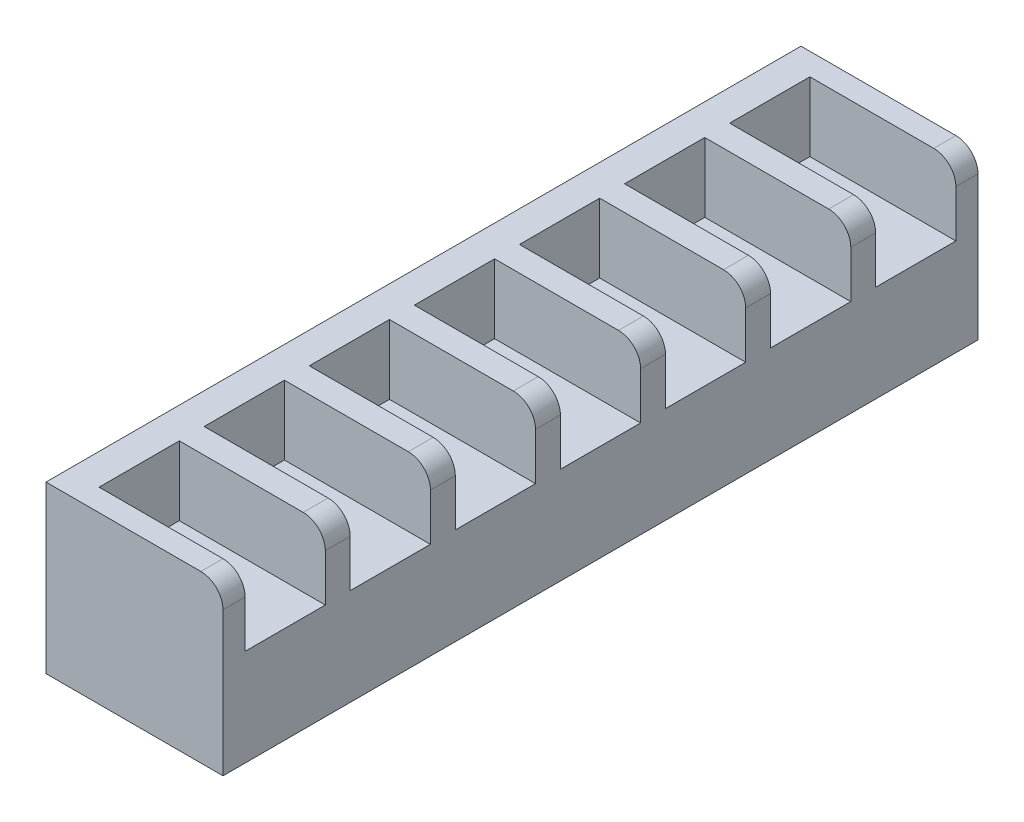
from build123d import *

# Parameters (mm, degrees)
SKETCH1_W           = 16
SKETCH1_H           = 68.25
BOSS_EXTRUDE1_DEPTH = 15
FILLET1_R           = 2
SKETCH2_W           = 13.2
SKETCH2_H           = 7.25
CUT_EXTRUDE1_DEPTH  = 6.25
LPATTERN1_COUNT     = 7
LPATTERN1_PITCH     = 9.5


with BuildPart() as part:
    # Sketch1 → Boss-Extrude1 (new body)
    with BuildSketch(Plane(origin=(0, 0, 0), x_dir=(1, 0, 0), z_dir=(0, 1, 0))):
        Rectangle(SKETCH1_W, SKETCH1_H)
    extrude(amount=BOSS_EXTRUDE1_DEPTH)

    # Fillet1
    fillet1_edges = [part.edges().sort_by_distance(p)[0] for p in [
        (8, 15, 0),
    ]]
    fillet(fillet1_edges, radius=FILLET1_R)

    # Sketch2 → Cut-Extrude1 (cut)
    with BuildSketch(Plane(origin=(0, 15, 0), x_dir=(1, 0, 0), z_dir=(0, 1, 0))):
        with Locations((1.4, -28.5)):
            Rectangle(SKETCH2_W, SKETCH2_H)
    cut_extrude1 = extrude(amount=-CUT_EXTRUDE1_DEPTH, mode=Mode.SUBTRACT)

    # LPattern1: Cut-Extrude1 ×7
    with Locations(*[(0, 0, -i * LPATTERN1_PITCH) for i in range(1, LPATTERN1_COUNT)]):
        add(cut_extrude1, mode=Mode.SUBTRACT)


solid = part.part
